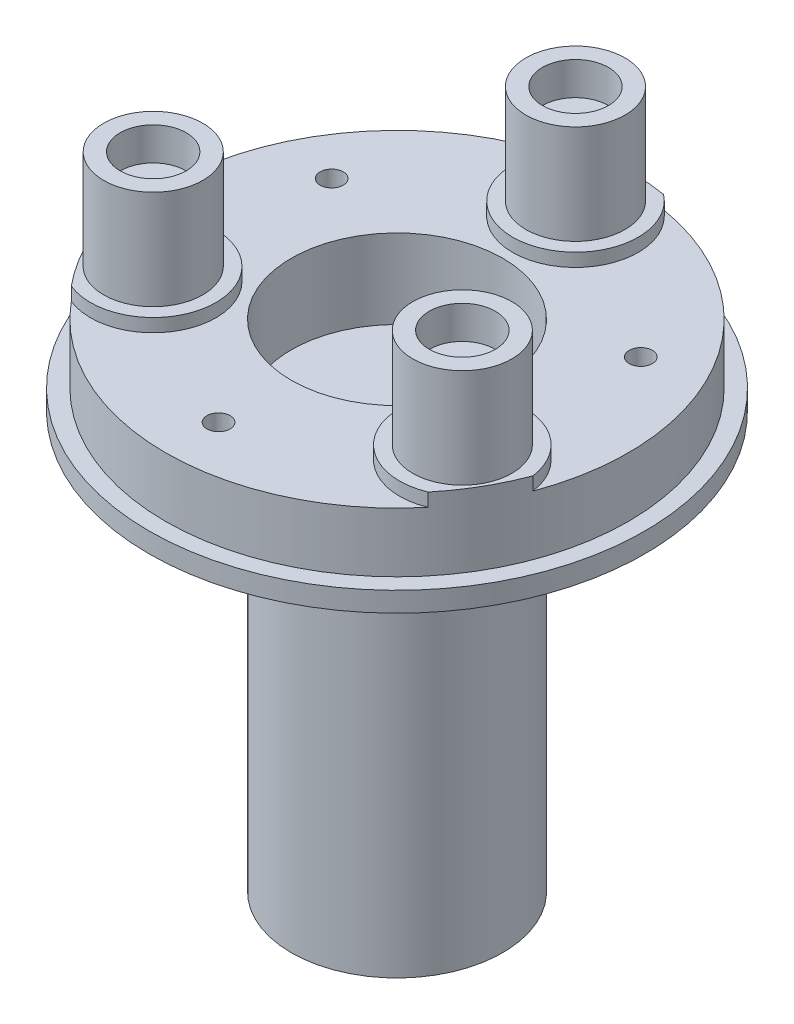
from build123d import *

# Parameters (mm, degrees)
SKETCH1_R                                     = 37.5
BOSS_EXTRUDE1_DEPTH                           = 3
SKETCH1_3_R                                   = 35
BOSS_EXTRUDE2_DEPTH                           = 12
SKETCH13_R                                    = 16
CUT_EXTRUDE6_DEPTH                            = 55.373706881
BOSS_EXTRUDE9_DEPTH                           = 2
SKETCH25_R                                    = 7.5
BOSS_EXTRUDE10_DEPTH                          = 15
SKETCH26_R                                    = 5
CUT_EXTRUDE9_DEPTH                            = 5
CBORE_FOR_M3_PAN_HEAD_MACHINE_SCREW1_AT_COUNT = 2
CBORE_FOR_M3_PAN_HEAD_MACHINE_SCREW1_AT_PITCH = 46.765371804
CBORE_FOR_M3_PAN_HEAD_MACHINE_SCREW1_2_COUNT  = 2
CBORE_FOR_M3_PAN_HEAD_MACHINE_SCREW1_2_PITCH  = 46.765371804
SKETCH29_R                                    = 1.75
CUT_EXTRUDE10_DEPTH                           = 56.691112397
SKETCH30_R                                    = 16
BOSS_EXTRUDE11_DEPTH                          = 63


with BuildPart() as part:
    # Sketch1 → Boss-Extrude1 (new body)
    with BuildSketch(Plane(origin=(0, 0, 0), x_dir=(1, 0, 0), z_dir=(0, 1, 0))):
        Circle(SKETCH1_R)
    extrude(amount=BOSS_EXTRUDE1_DEPTH)

    # Sketch1<3> → Boss-Extrude2 (add)
    with BuildSketch(Plane(origin=(0, 0, 0), x_dir=(1, 0, 0), z_dir=(0, 1, 0))):
        Circle(SKETCH1_3_R)
    extrude(amount=BOSS_EXTRUDE2_DEPTH)

    # Sketch13 → Cut-Extrude6 (cut, through all)
    with BuildSketch(Plane(origin=(0, 12, 0), x_dir=(1, 0, 0), z_dir=(0, 1, 0))):
        Circle(SKETCH13_R)
    extrude(amount=-CUT_EXTRUDE6_DEPTH, mode=Mode.SUBTRACT)

    # Sketch24 → Boss-Extrude9 (add)
    with BuildSketch(Plane(origin=(0, 12, 0), x_dir=(1, 0, 0), z_dir=(0, 1, 0))):
        with BuildLine():
            ThreePointArc((5.813043417, 34.513888889), (0, 35), (-5.813043417, 34.513888889))
            ThreePointArc((-5.813043417, 34.513888889), (0, 17.5), (5.813043417, 34.513888889))
        make_face()
        with BuildLine():
            ThreePointArc((-26.983382853, -22.291187717), (-15.155444566, -8.75), (-32.79642627, -12.222701172))
            ThreePointArc((-32.79642627, -12.222701172), (-30.310889132, -17.5), (-26.983382853, -22.291187717))
        make_face()
        with BuildLine():
            ThreePointArc((26.983382853, -22.291187717), (30.310889132, -17.5), (32.79642627, -12.222701172))
            ThreePointArc((32.79642627, -12.222701172), (15.155444566, -8.75), (26.983382853, -22.291187717))
        make_face()
    extrude(amount=BOSS_EXTRUDE9_DEPTH)

    # Sketch25 → Boss-Extrude10 (add)
    with BuildSketch(Plane(origin=(0, 14, 0), x_dir=(1, 0, 0), z_dir=(0, 1, 0))):
        with Locations((0, 27)):
            Circle(SKETCH25_R)
        with Locations((23.382685902, -13.5)):
            Circle(SKETCH25_R)
        with Locations((-23.382685902, -13.5)):
            Circle(SKETCH25_R)
    extrude(amount=BOSS_EXTRUDE10_DEPTH)

    # Sketch26 → Cut-Extrude9 (cut)
    with BuildSketch(Plane(origin=(0, 29, 0), x_dir=(1, 0, 0), z_dir=(0, 1, 0))):
        with Locations((0, 27)):
            Circle(SKETCH26_R)
        with Locations((23.382685902, -13.5)):
            Circle(SKETCH26_R)
        with Locations((-23.382685902, -13.5)):
            Circle(SKETCH26_R)
    extrude(amount=-CUT_EXTRUDE9_DEPTH, mode=Mode.SUBTRACT)

    # Sketch28 → CBORE for M3 Pan Head Machine Screw1 (revolve, cut)
    with BuildSketch(Plane(origin=(0, 0, -27), x_dir=(0, 0, -1), z_dir=(1, 0, 0))):
        Polygon((0, 0), (0, 29), (1.8, 29), (1.8, 2.4), (3.5, 2.4), (3.5, 0.025), (3.525, 0), align=None)
    cbore_for_m3_pan_head_machine_screw1 = revolve(axis=Axis((0, -6.35, -27), (0, 1, 0)), mode=Mode.SUBTRACT)

    # CBORE for M3 Pan Head Machine Screw1 at: CBORE for M3 Pan Head Machine Screw1 ×2
    with Locations(*[Vector(-0.5000000000000369, 0, 0.8660254037844174) * (i * CBORE_FOR_M3_PAN_HEAD_MACHINE_SCREW1_AT_PITCH) for i in range(1, CBORE_FOR_M3_PAN_HEAD_MACHINE_SCREW1_AT_COUNT)]):
        add(cbore_for_m3_pan_head_machine_screw1, mode=Mode.SUBTRACT)

    # CBORE for M3 Pan Head Machine Screw1 2: CBORE for M3 Pan Head Machine Screw1 ×2
    with Locations(*[Vector(0.49999999999996353, 0, 0.8660254037844598) * (i * CBORE_FOR_M3_PAN_HEAD_MACHINE_SCREW1_2_PITCH) for i in range(1, CBORE_FOR_M3_PAN_HEAD_MACHINE_SCREW1_2_COUNT)]):
        add(cbore_for_m3_pan_head_machine_screw1, mode=Mode.SUBTRACT)

    # Sketch29 → Cut-Extrude10 (cut, through all)
    with BuildSketch(Plane(origin=(0, 12, 0), x_dir=(1, 0, 0), z_dir=(0, 1, 0))):
        with Locations((23.382685902, 13.5)):
            Circle(SKETCH29_R)
        with Locations((0, -27)):
            Circle(SKETCH29_R)
        with Locations((-23.382685902, 13.5)):
            Circle(SKETCH29_R)
    extrude(amount=-CUT_EXTRUDE10_DEPTH, mode=Mode.SUBTRACT)


with BuildPart() as body_2:
    # Sketch30 → Boss-Extrude11 (new body)
    with BuildSketch(Plane.XZ):
        Circle(SKETCH30_R)
    extrude(amount=BOSS_EXTRUDE11_DEPTH)


solid = Compound([part.part, body_2.part])
